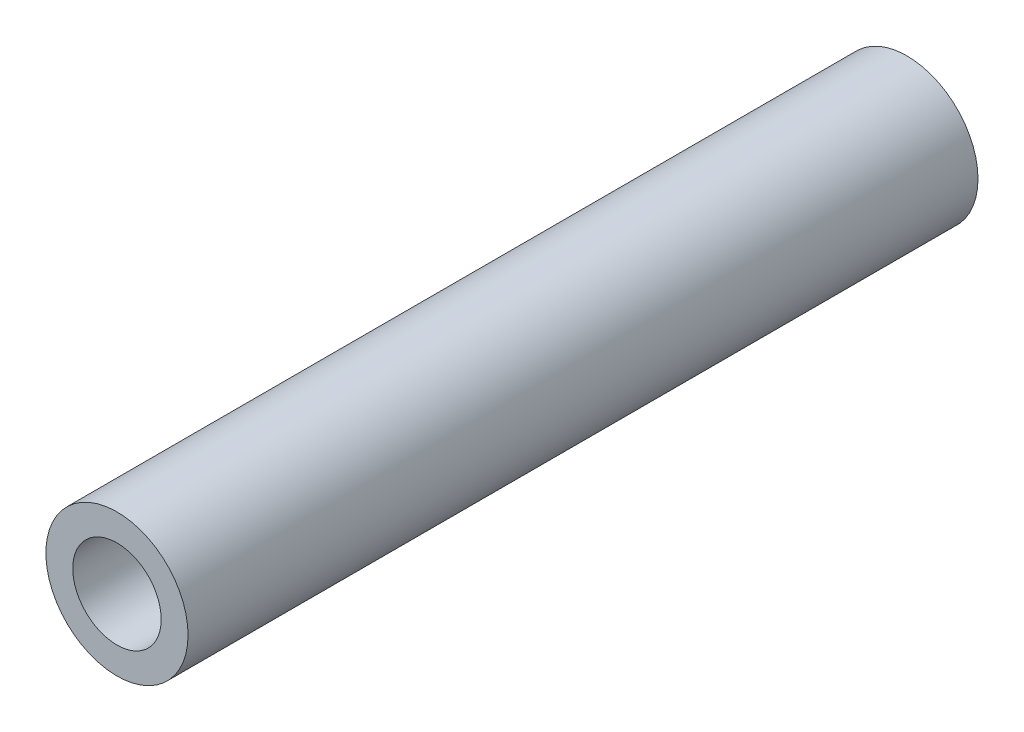
from build123d import *

# Parameters (mm, degrees)
CROQUIS1_R              = 1.8
CROQUIS1_R_2            = 1.12
SALIENTE_EXTRUIR1_DEPTH = 20


with BuildPart() as part:
    # Croquis1 → Saliente-Extruir1 (new body)
    with BuildSketch(Plane.XY):
        Circle(CROQUIS1_R)
        Circle(CROQUIS1_R_2, mode=Mode.SUBTRACT)
    extrude(amount=SALIENTE_EXTRUIR1_DEPTH)


solid = part.part
